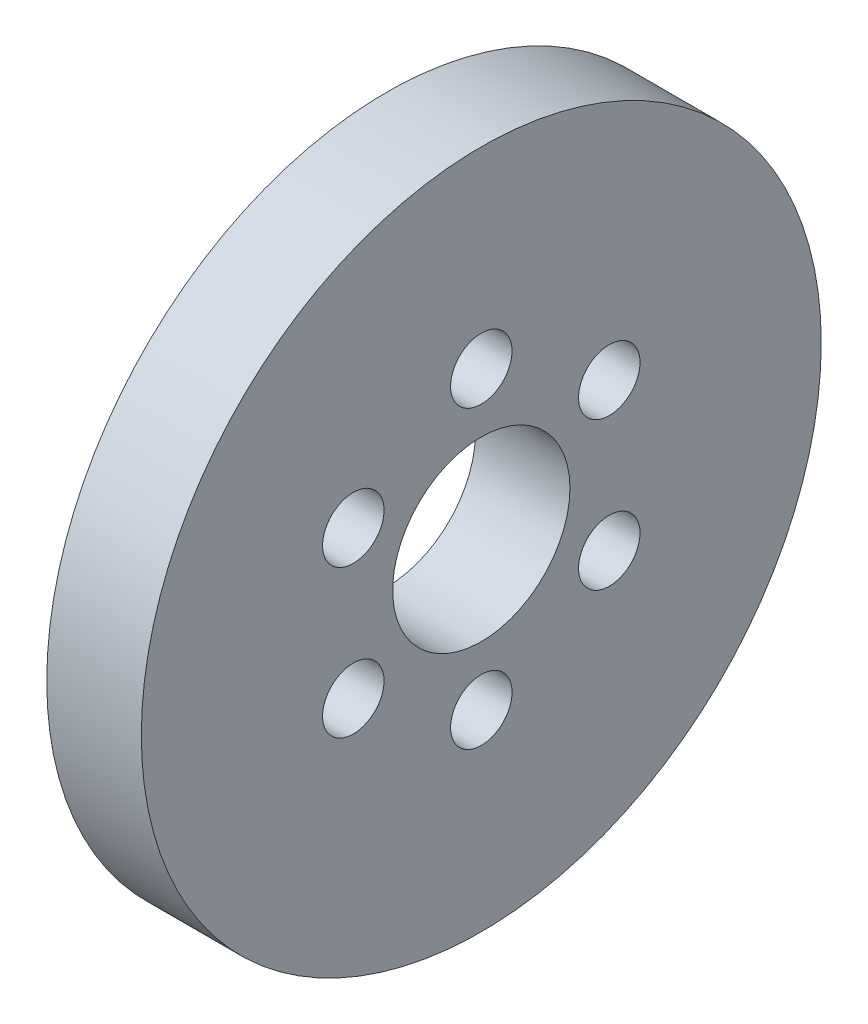
from build123d import *

# Parameters (mm, degrees)
SKETCH1_R                 = 18.26006
BOSS_EXTRUDE1_DEPTH       = 5.08
F_4_CLEARANCE_HOLE1_D     = 3.302
F_4_CLEARANCE_HOLE2_D     = 9.525
F_4_CLEARANCE_HOLE2_DEPTH = 57.15
F_4_CLEARANCE_HOLE2_TIP   = 2.861598698


with BuildPart() as part:
    # Sketch1 → Boss-Extrude1 (new body)
    with BuildSketch(Plane(origin=(0, 0, 0), x_dir=(0, 0, -1), z_dir=(1, 0, 0))):
        Circle(SKETCH1_R)
    extrude(amount=BOSS_EXTRUDE1_DEPTH)

    # #4 Clearance Hole1 (through all)
    with Locations(Plane(origin=(5.08, 0, 0), x_dir=(0, 0, -1), z_dir=(1, 0, 0))):
        with Locations((0, 7.9375), (6.874076643, 3.96875), (6.874076643, -3.96875), (0, -7.9375), (-6.874076643, -3.96875), (-6.874076643, 3.96875), (0, 0)):
            Hole(F_4_CLEARANCE_HOLE1_D / 2)

    # #4 Clearance Hole2
    with Locations(Plane(origin=(5.08, 0, 0), x_dir=(0, 0, -1), z_dir=(1, 0, 0))):
        with Locations((0, 0)):
            Hole(F_4_CLEARANCE_HOLE2_D / 2, depth=F_4_CLEARANCE_HOLE2_DEPTH)
            with Locations((0, 0, -(F_4_CLEARANCE_HOLE2_DEPTH + F_4_CLEARANCE_HOLE2_TIP / 2))):  # 118° drill point
                Cone(0, F_4_CLEARANCE_HOLE2_D / 2, F_4_CLEARANCE_HOLE2_TIP, mode=Mode.SUBTRACT)


solid = part.part
